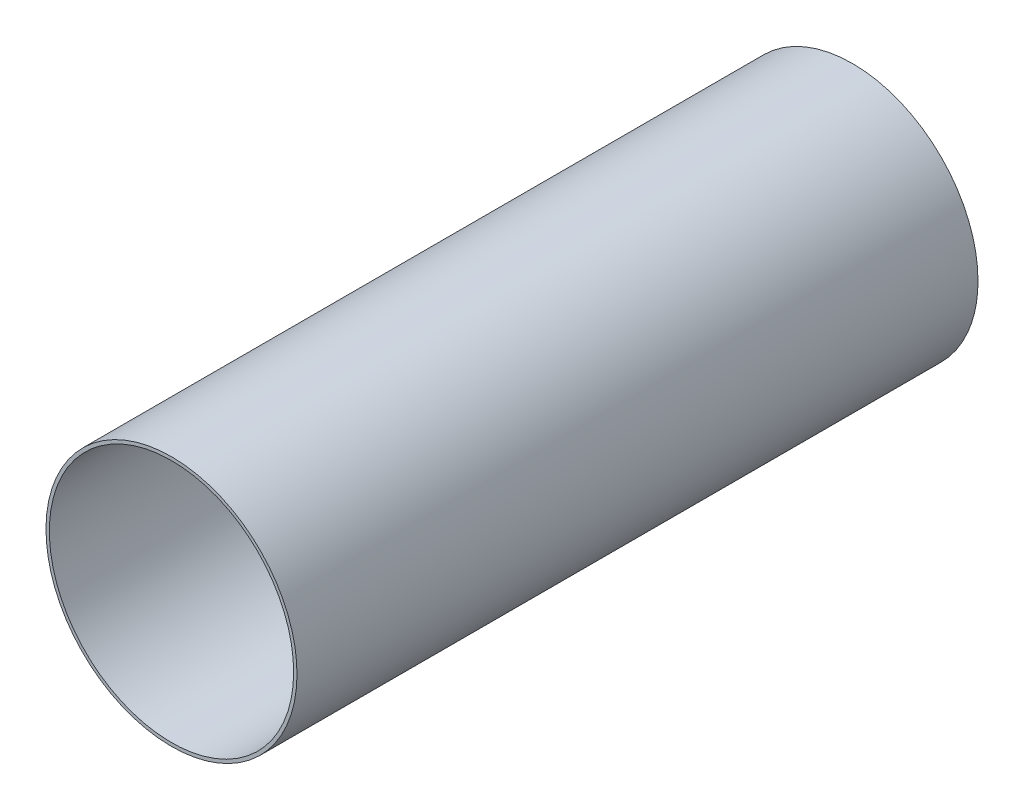
from build123d import *

# Parameters (mm, degrees)
SCHIZZO1_R                = 75
SCHIZZO1_R_2              = 73
ESTRUSIONE_SOTTILE1_DEPTH = 406.968470742


with BuildPart() as part:
    # Schizzo1 → Estrusione-Sottile1 (new body)
    with BuildSketch(Plane.XY):
        Circle(SCHIZZO1_R)
        Circle(SCHIZZO1_R_2, mode=Mode.SUBTRACT)
    extrude(amount=ESTRUSIONE_SOTTILE1_DEPTH)


solid = part.part
